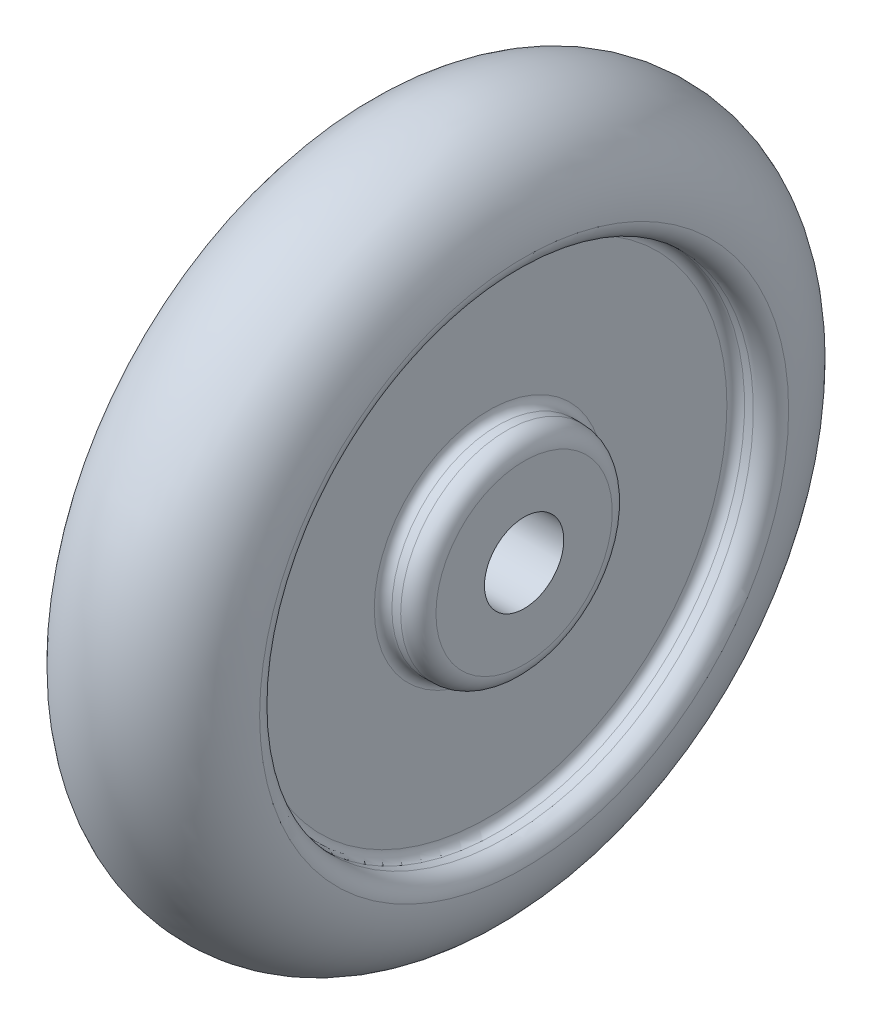
from build123d import *


with BuildPart() as part:
    # Sketch1 → Revolve1 (revolve)
    with BuildSketch(Plane.XY, mode=Mode.PRIVATE) as revolve1_sk:
        with BuildLine():
            Line((-4, 14), (-3.5, 14))
            ThreePointArc((-3.5, 14), (-3.146446609, 13.853553391), (-3, 13.5))
            Line((-3, 13.5), (-3, 6.5))
            ThreePointArc((-3, 6.5), (-3.146446609, 6.146446609), (-3.5, 6))
            Line((-3.5, 6), (-4, 6))
            ThreePointArc((-4, 6), (-4.707106781, 5.707106781), (-5, 5))
            Line((-5, 5), (-5, 2.25))
            Line((-5, 2.25), (5, 2.25))
            Line((5, 2.25), (5, 5))
            ThreePointArc((5, 5), (4.707106781, 5.707106781), (4, 6))
            Line((4, 6), (3.5, 6))
            ThreePointArc((3.5, 6), (3.146446609, 6.146446609), (3, 6.5))
            Line((3, 6.5), (3, 13.5))
            ThreePointArc((3, 13.5), (3.146446609, 13.853553391), (3.5, 14))
            Line((3.5, 14), (4, 14))
            ThreePointArc((4, 14), (4.707106781, 14.292893219), (5, 15))
            ThreePointArc((5, 15), (0, 20), (-5, 15))
            ThreePointArc((-5, 15), (-4.707106781, 14.292893219), (-4, 14))
        make_face()
    revolve(revolve1_sk.sketch.rotate(Axis((-8.922780681, 0, 0), (1, 0, 0)), 90), axis=Axis((-8.922780681, 0, 0), (1, 0, 0)))


solid = part.part
